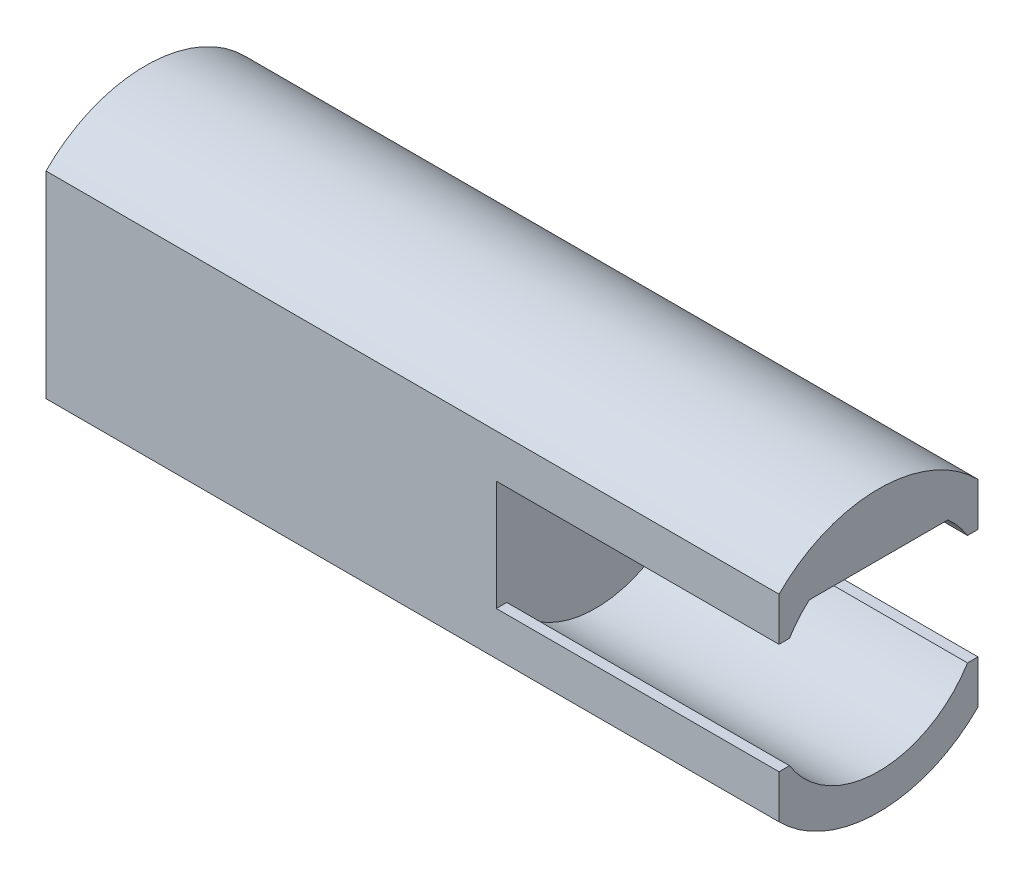
from build123d import *

# Parameters (mm, degrees)
BOSS_EXTRUDE1_DEPTH   = 5.4
BOSS_EXTRUDE1_2_DEPTH = 5.4
BOSS_EXTRUDE2_START   = 8.6
BOSS_EXTRUDE2_DEPTH   = 8.6


with BuildPart() as part:
    # Sketch2 → Boss-Extrude1 (new body)
    with BuildSketch(Plane(origin=(0, 0, 0), x_dir=(0, 0, -1), z_dir=(1, 0, 0))):
        with BuildLine():
            Line((-1.9, -1.882983006), (-1.9, -1.053565375))
            Line((-1.9, -1.053565375), (-1.7, -1.053565375))
            ThreePointArc((-1.7, -1.053565375), (0, -2), (1.7, -1.053565375))
            Line((1.7, -1.053565375), (1.9, -1.053565375))
            Line((1.9, -1.053565375), (1.9, -1.882983006))
            ThreePointArc((1.9, -1.882983006), (0, -2.675), (-1.9, -1.882983006))
        make_face()
    extrude(amount=BOSS_EXTRUDE1_DEPTH)



with BuildPart() as body_2:
    # Sketch2 → Boss-Extrude1 2 (new body)
    with BuildSketch(Plane(origin=(0, 0, 0), x_dir=(0, 0, -1), z_dir=(1, 0, 0))):
        with BuildLine():
            Line((-1.9, 1.882983006), (-1.9, 1.053565375))
            Line((-1.9, 1.053565375), (-1.7, 1.053565375))
            ThreePointArc((-1.7, 1.053565375), (-1.527831887, 1.290631521), (-1.322875656, 1.5))
            Line((-1.322875656, 1.5), (1.322875656, 1.5))
            ThreePointArc((1.322875656, 1.5), (1.527831887, 1.290631521), (1.7, 1.053565375))
            Line((1.7, 1.053565375), (1.9, 1.053565375))
            Line((1.9, 1.053565375), (1.9, 1.882983006))
            ThreePointArc((1.9, 1.882983006), (0, 2.675), (-1.9, 1.882983006))
        make_face()
    extrude(amount=BOSS_EXTRUDE1_2_DEPTH)


with BuildPart() as part_1:
    add(part.part)

    add(body_2.part)  # Boss-Extrude2 merges body 2
    # Sketch3 → Boss-Extrude2 (add)
    with BuildSketch(Plane.ZY.offset(BOSS_EXTRUDE2_START)):
        with BuildLine():
            Line((1.9, -1.882983006), (1.9, 1.882983006))
            ThreePointArc((1.9, 1.882983006), (0, 2.675), (-1.9, 1.882983006))
            Line((-1.9, 1.882983006), (-1.9, -1.882983006))
            ThreePointArc((-1.9, -1.882983006), (0, -2.675), (1.9, -1.882983006))
        make_face()
    extrude(amount=-BOSS_EXTRUDE2_DEPTH)


solid = part_1.part
